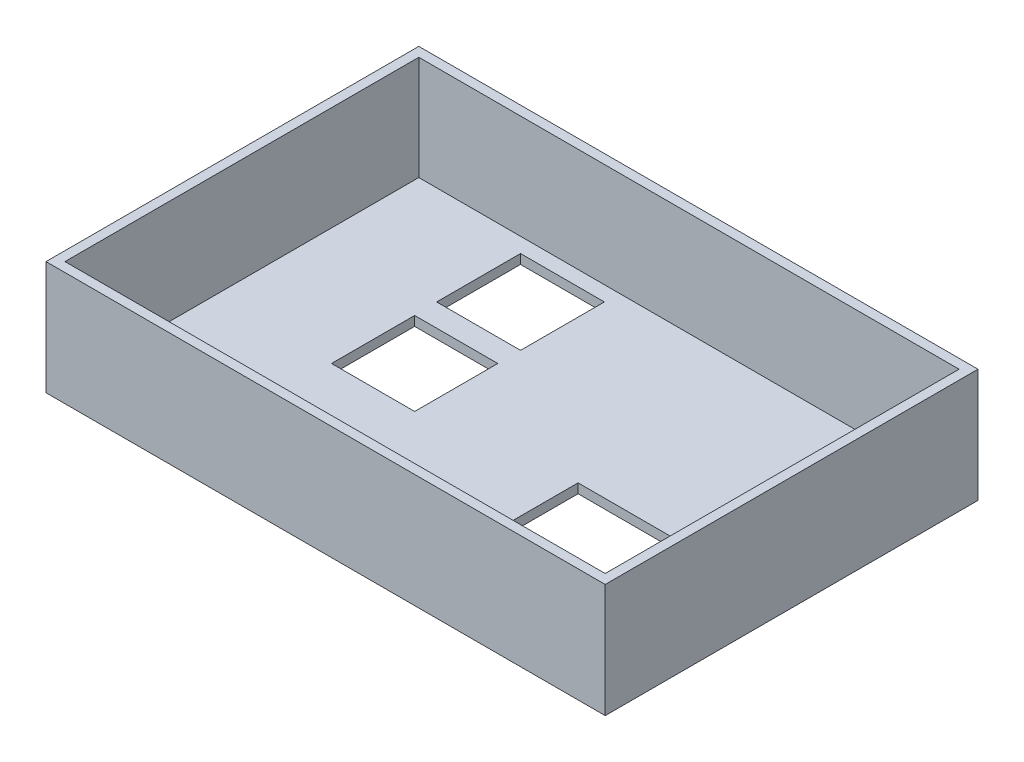
from build123d import *

# Parameters (mm, degrees)
SKETCH1_W           = 150
SKETCH1_H           = 100
BOSS_EXTRUDE1_DEPTH = 30.48
SHELL1_T            = -2.54
SKETCH3_W           = 44.02563229
SKETCH3_H           = 32.399815971
CUT_EXTRUDE1_DEPTH  = 30.48
SKETCH4_W           = 22.298696875
SKETCH4_H           = 22.298696874
CUT_EXTRUDE2_DEPTH  = 30.48
SKETCH5_W           = 22.489284027
SKETCH5_H           = 22.489284027
CUT_EXTRUDE3_DEPTH  = 30.48


with BuildPart() as part:
    # Sketch1 → Boss-Extrude1 (new body)
    with BuildSketch(Plane(origin=(0, 0, 0), x_dir=(1, 0, 0), z_dir=(0, 1, 0))):
        with Locations((-34.332023576, -18.664047151)):
            Rectangle(SKETCH1_W, SKETCH1_H)
    extrude(amount=-BOSS_EXTRUDE1_DEPTH)

    # Shell1
    shell1_openings = [part.faces().sort_by_distance(p)[0] for p in [
        (-34.332023576, 0, 18.664047151),
    ]]
    offset(amount=SHELL1_T, openings=shell1_openings, kind=Kind.INTERSECTION)

    # Sketch3 → Cut-Extrude1 (cut)
    with BuildSketch(Plane.XZ.offset(30.48)):
        with Locations((7.501856458, 36.960413817)):
            Rectangle(SKETCH3_W, SKETCH3_H)
    extrude(amount=-CUT_EXTRUDE1_DEPTH, mode=Mode.SUBTRACT)

    # Sketch4 → Cut-Extrude2 (cut)
    with BuildSketch(Plane(origin=(0, -30.48, 0), x_dir=(-1, 0, 0), z_dir=(0, -1, 0))):
        with Locations((64.158912985, -14.947597672)):
            Rectangle(SKETCH4_W, SKETCH4_H)
    extrude(amount=-CUT_EXTRUDE2_DEPTH, mode=Mode.SUBTRACT)

    # Sketch5 → Cut-Extrude3 (cut)
    with BuildSketch(Plane.XZ.offset(30.48)):
        with Locations((-64.254206561, -13.545181668)):
            Rectangle(SKETCH5_W, SKETCH5_H)
    extrude(amount=-CUT_EXTRUDE3_DEPTH, mode=Mode.SUBTRACT)


solid = part.part
